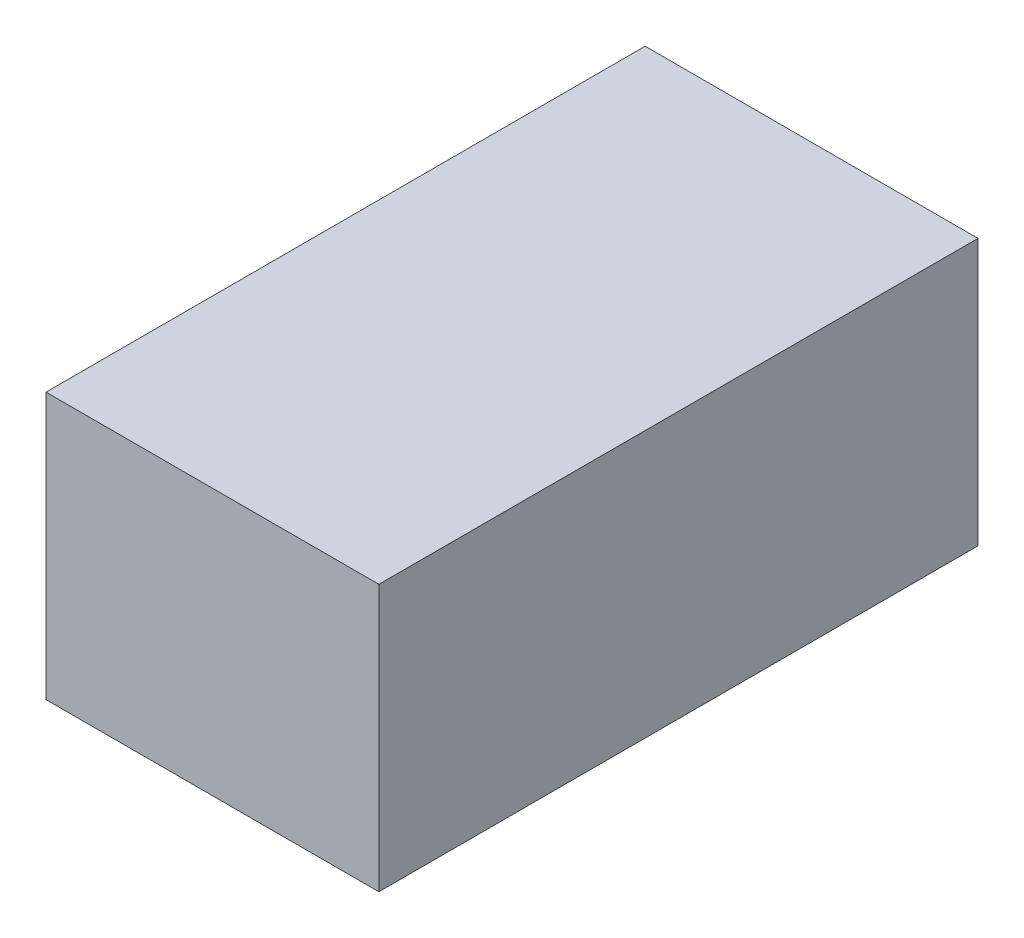
from build123d import *

# Parameters (mm, degrees)
SKETCH1_W           = 30
SKETCH1_H           = 24
BOSS_EXTRUDE1_DEPTH = 54


with BuildPart() as part:
    # Sketch1 → Boss-Extrude1 (new body)
    with BuildSketch(Plane.XY):
        with Locations((15, 12)):
            Rectangle(SKETCH1_W, SKETCH1_H)
    extrude(amount=BOSS_EXTRUDE1_DEPTH)


solid = part.part
